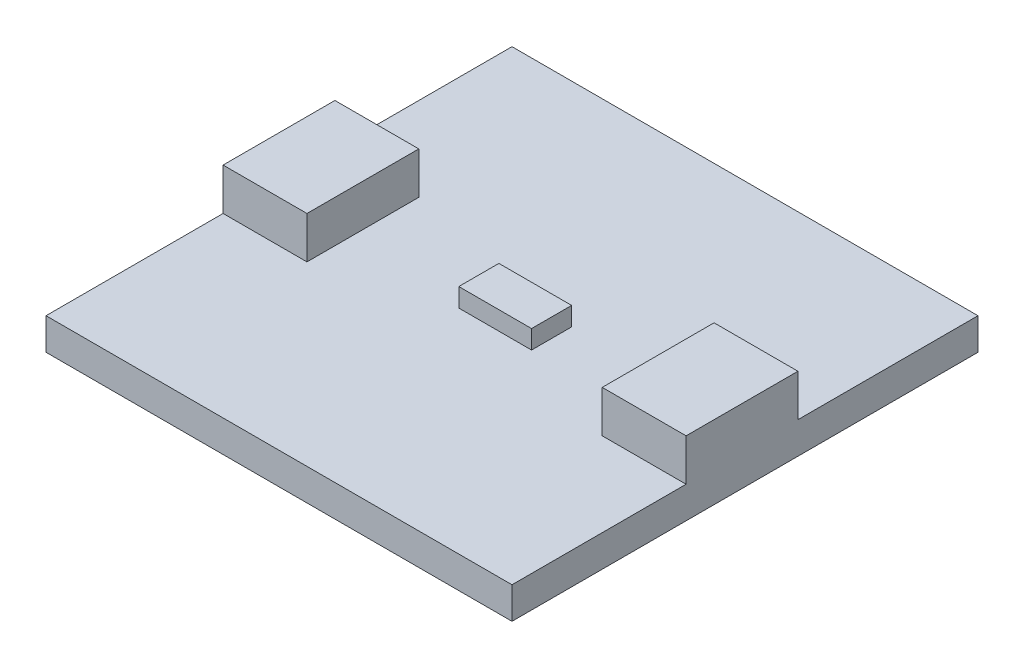
from build123d import *

# Parameters (mm, degrees)
SKETCH1_W           = 25.4
SKETCH1_H           = 25.4
BOSS_EXTRUDE1_DEPTH = 1.7272
SKETCH2_W           = 4.572
SKETCH2_H           = 6.096
BOSS_EXTRUDE2_DEPTH = 2.286
SKETCH3_W           = 3.965650052
SKETCH3_H           = 2.184801971
BOSS_EXTRUDE3_DEPTH = 1.016


with BuildPart() as part:
    # Sketch1 → Boss-Extrude1 (new body)
    with BuildSketch(Plane(origin=(0, 0, 0), x_dir=(1, 0, 0), z_dir=(0, 1, 0))):
        with Locations((12.7, -12.7)):
            Rectangle(SKETCH1_W, SKETCH1_H)
    extrude(amount=BOSS_EXTRUDE1_DEPTH)

    # Sketch2 → Boss-Extrude2 (add)
    with BuildSketch(Plane(origin=(0, 1.7272, 0), x_dir=(1, 0, 0), z_dir=(0, 1, 0))):
        with Locations((2.286, -12.7)):
            Rectangle(SKETCH2_W, SKETCH2_H)
        with Locations((23.114, -12.862541555)):
            Rectangle(SKETCH2_W, SKETCH2_H)
    extrude(amount=BOSS_EXTRUDE2_DEPTH)

    # Sketch3 → Boss-Extrude3 (add)
    with BuildSketch(Plane(origin=(0, 1.7272, 0), x_dir=(1, 0, 0), z_dir=(0, 1, 0))):
        with Locations((12.871725194, -12.696151293)):
            Rectangle(SKETCH3_W, SKETCH3_H)
    extrude(amount=BOSS_EXTRUDE3_DEPTH)


solid = part.part
